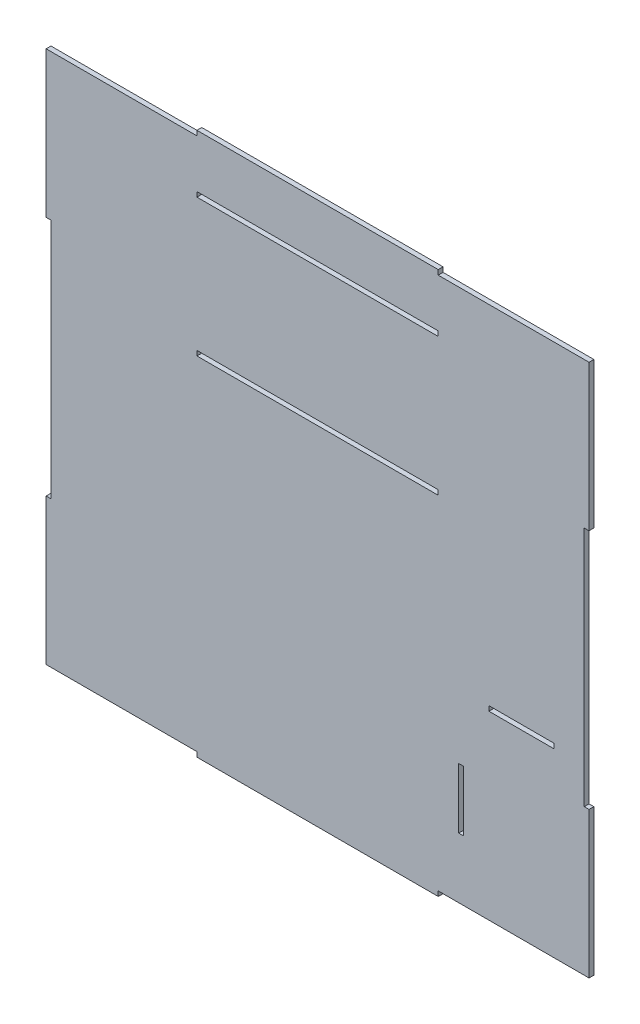
from build123d import *

# Parameters (mm, degrees)
SKETCH1_W           = 4
SKETCH1_H           = 50
SKETCH1_W_2         = 54
SKETCH1_H_2         = 4
SKETCH1_W_3         = 200
BOSS_EXTRUDE1_DEPTH = 4


with BuildPart() as part:
    # Sketch1 → Boss-Extrude1 (new body)
    with BuildSketch(Plane.XY):
        Polygon((-253.680268675, -226.899422354), (-128.680268675, -226.899422354), (-128.680268675, -230.899422354), (71.319731325, -230.899422354), (71.319731325, -226.899422354), (196.319731325, -226.899422354), (196.319731325, -105.899422354), (192.319731325, -105.899422354), (192.319731325, 94.100577646), (196.319731325, 94.100577646), (196.319731325, 215.100577646), (71.319731325, 215.100577646), (71.319731325, 219.100577646), (-128.680268675, 219.100577646), (-128.680268675, 215.100577646), (-253.680268675, 215.100577646), (-253.680268675, 94.100577646), (-249.680268675, 94.100577646), (-249.680268675, -105.899422354), (-253.680268675, -105.899422354), align=None)
        with Locations((90.319731325, -151.899422354)):
            Rectangle(SKETCH1_W, SKETCH1_H, mode=Mode.SUBTRACT)
        with Locations((140.319731325, -74.899422354)):
            Rectangle(SKETCH1_W_2, SKETCH1_H_2, mode=Mode.SUBTRACT)
        with Locations((-28.680268675, 59.100577646)):
            Rectangle(SKETCH1_W_3, SKETCH1_H_2, mode=Mode.SUBTRACT)
        with Locations((-28.680268675, 173.100577646)):
            Rectangle(SKETCH1_W_3, SKETCH1_H_2, mode=Mode.SUBTRACT)
    extrude(amount=BOSS_EXTRUDE1_DEPTH)


solid = part.part
